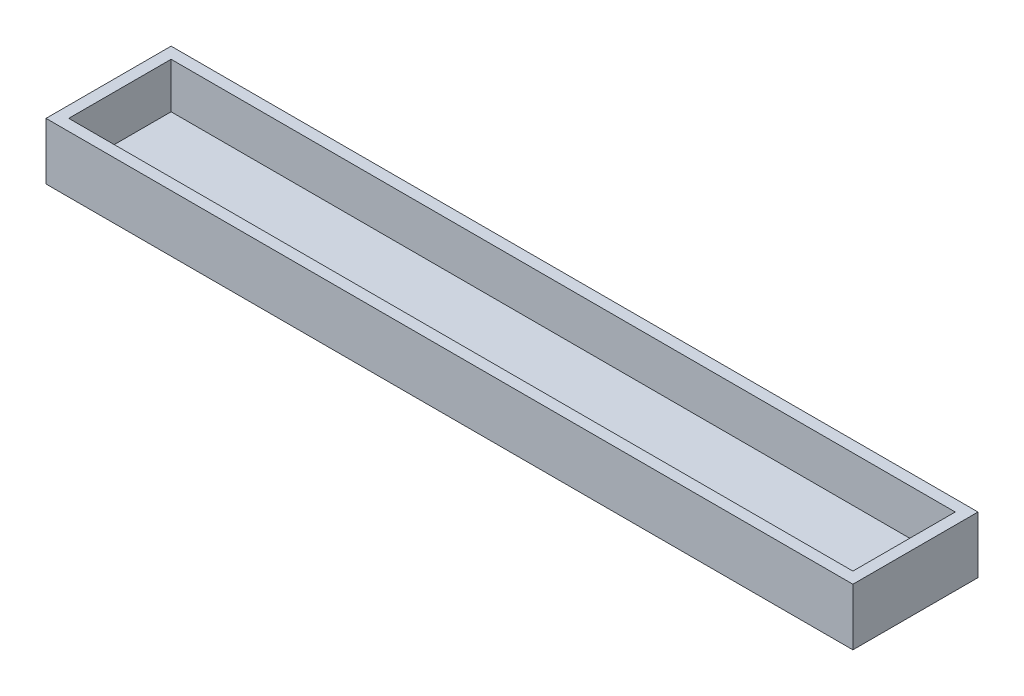
from build123d import *

# Parameters (mm, degrees)
ESBO_O1_W                = 55
ESBO_O1_H                = 25
RESSALTO_EXTRUS_O1_DEPTH = 354.77
CASCA1_T                 = -5
ESBO_O3_W                = 4
ESBO_O3_H                = 30
CORTE_EXTRUS_O1_DEPTH    = 360.564671374


with BuildPart() as part:
    # Esboço1 → Ressalto-extrusão1 (new body)
    with BuildSketch(Plane(origin=(0, 0, 0), x_dir=(0, 0, -1), z_dir=(1, 0, 0))):
        with Locations((27.5, 12.5)):
            Rectangle(ESBO_O1_W, ESBO_O1_H)
    extrude(amount=RESSALTO_EXTRUS_O1_DEPTH)

    # Casca1
    casca1_openings = [part.faces().sort_by_distance(p)[0] for p in [
        (177.385, 25, -27.5),
    ]]
    offset(amount=CASCA1_T, openings=casca1_openings, kind=Kind.INTERSECTION)

    # Esboço3 → Corte-extrusão1 (cut, through all)
    with BuildSketch(Plane(origin=(0, 5, 0), x_dir=(1, 0, 0), z_dir=(0, 1, 0))):
        with Locations((347.77, 27.5)):
            Rectangle(ESBO_O3_W, ESBO_O3_H)
    extrude(amount=-CORTE_EXTRUS_O1_DEPTH, mode=Mode.SUBTRACT)


solid = part.part
